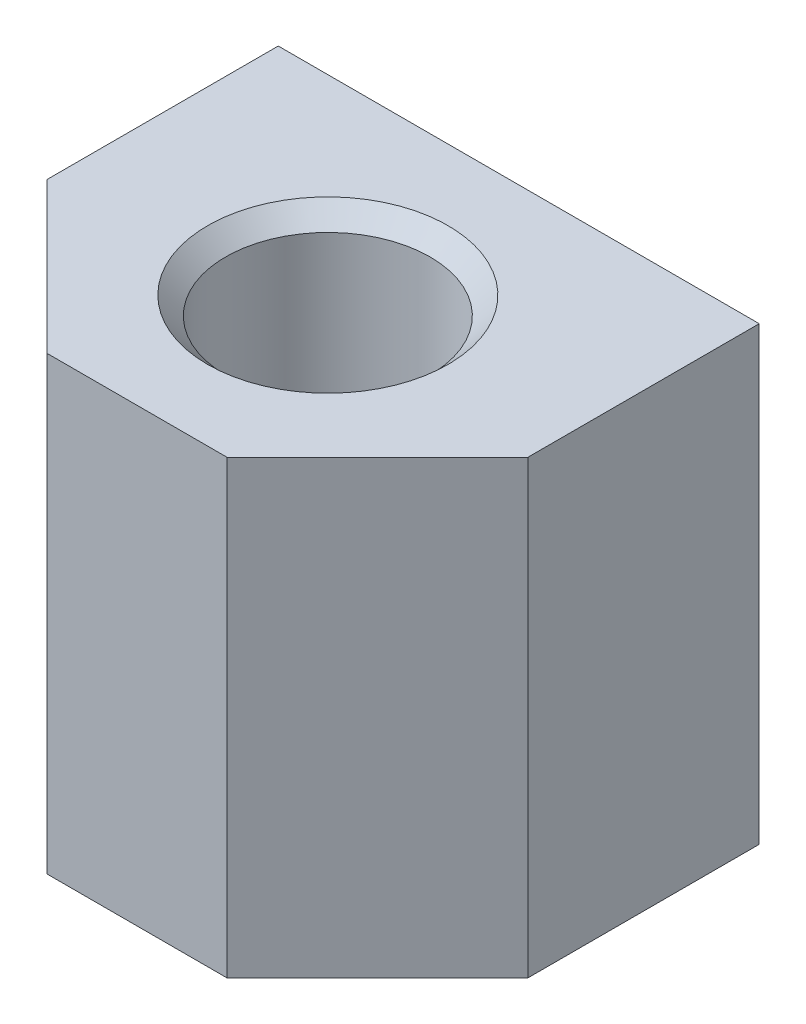
from build123d import *

# Parameters (mm, degrees)
RESSALTO_EXTRUS_O1_DEPTH        = 7.5
FURO_ROSCADO_DE_M31_D           = 2.5
FURO_ROSCADO_DE_M31_DEPTH       = 7.5
FURO_ROSCADO_DE_M31_CSINK_D     = 3.05
FURO_ROSCADO_DE_M31_CSINK_ANGLE = 90
FURO_ROSCADO_DE_M31_TIP         = 0.751075774
CHANFRO1_SIZE                   = 5


with BuildPart() as part:
    # Esboço1 → Ressalto-extrusão1 (new, symmetric)
    with BuildSketch(Plane(origin=(0, 0, 0), x_dir=(1, 0, 0), z_dir=(0, 1, 0))):
        Polygon((3.666174209, 6.35), (-3.666174209, 6.35), (-8, 6.35), (-8, -6.35), (8, -6.35), (8, 6.35), align=None)
    extrude(amount=RESSALTO_EXTRUS_O1_DEPTH, both=True)

    # Esboço5 → Furo roscado de M81 (revolve, cut)
    with BuildSketch(Plane(origin=(0, 7.5, 0), x_dir=(0, 0, 1), z_dir=(1, 0, 0))):
        Polygon((0, 0), (0, 15), (4, 15), (3.4, 14.4), (3.4, 0.6), (4, 0), align=None)
    revolve(axis=Axis((0, 13.85, 0), (0, -1, 0)), mode=Mode.SUBTRACT)

    # Furo roscado de M31
    with Locations(Plane(origin=(0, 0, -6.35), x_dir=(-1, 0, 0), z_dir=(0, 0, -1))):
        with Locations((-6, 0), (6, 0)):
            CounterSinkHole(FURO_ROSCADO_DE_M31_D / 2, FURO_ROSCADO_DE_M31_CSINK_D / 2, depth=FURO_ROSCADO_DE_M31_DEPTH, counter_sink_angle=FURO_ROSCADO_DE_M31_CSINK_ANGLE)
            with Locations((0, 0, -(FURO_ROSCADO_DE_M31_DEPTH + FURO_ROSCADO_DE_M31_TIP / 2))):  # 118° drill point
                Cone(0, FURO_ROSCADO_DE_M31_D / 2, FURO_ROSCADO_DE_M31_TIP, mode=Mode.SUBTRACT)

    # Chanfro1
    chanfro1_edges = [part.edges().sort_by_distance(p)[0] for p in [
        (8, 0, 6.35),
        (-8, 0, 6.35),
    ]]
    chamfer(chanfro1_edges, length=CHANFRO1_SIZE)


solid = part.part
